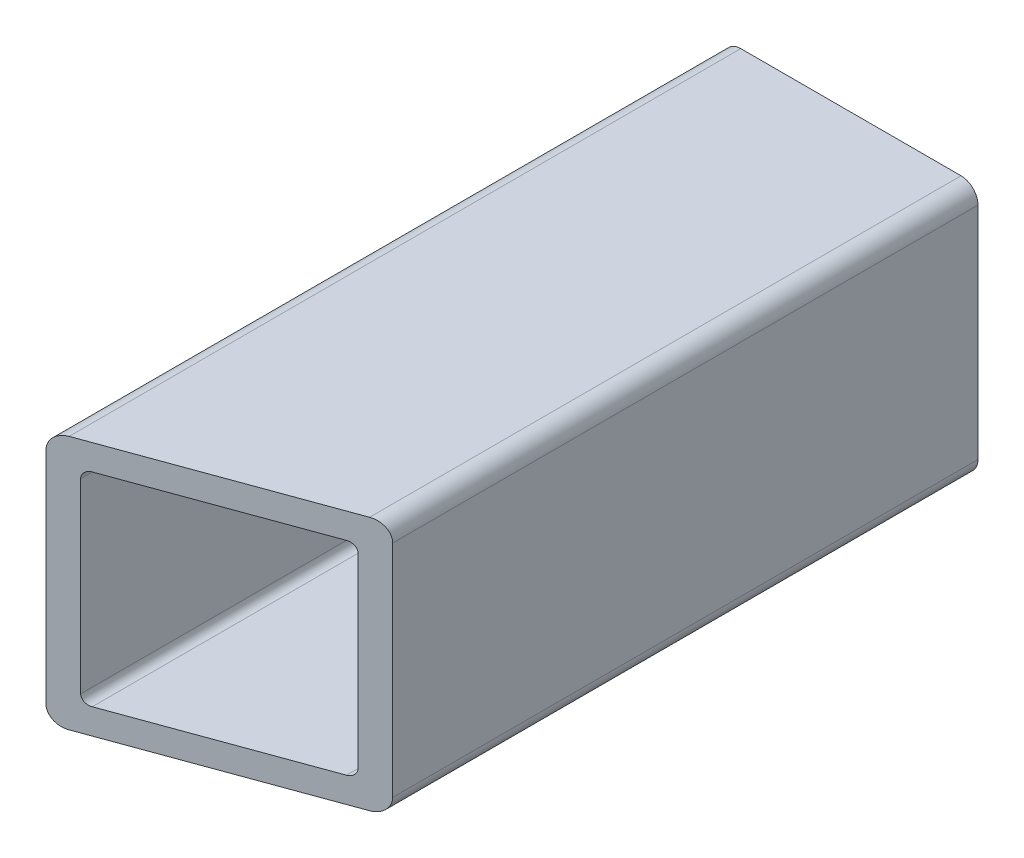
from build123d import *

# Parameters (mm, degrees)
DODANIE_WYCI_GNI_CIE1_DEPTH = 80
WYTNIJ_WYCI_GNI_CIE1_DEPTH  = 70


with BuildPart() as part:
    # Szkic1 → Dodanie-wyciągnięcie1 (new body)
    with BuildSketch(Plane.XY):
        with BuildLine():
            Line((-13, -3), (13, -3))
            ThreePointArc((13, -3), (14.414213562, -2.414213562), (15, -1))
            Line((15, -1), (15, 25))
            ThreePointArc((15, 25), (14.414213562, 26.414213562), (13, 27))
            Line((13, 27), (-13, 27))
            ThreePointArc((-13, 27), (-14.414213562, 26.414213562), (-15, 25))
            Line((-15, 25), (-15, -1))
            ThreePointArc((-15, -1), (-14.414213562, -2.414213562), (-13, -3))
        make_face()
        with BuildLine():
            Line((-11, 0), (11, 0))
            ThreePointArc((11, 0), (11.707106781, 0.292893219), (12, 1))
            Line((12, 1), (12, 23))
            ThreePointArc((12, 23), (11.707106781, 23.707106781), (11, 24))
            Line((11, 24), (-11, 24))
            ThreePointArc((-11, 24), (-11.707106781, 23.707106781), (-12, 23))
            Line((-12, 23), (-12, 1))
            ThreePointArc((-12, 1), (-11.707106781, 0.292893219), (-11, 0))
        make_face(mode=Mode.SUBTRACT)
    extrude(amount=DODANIE_WYCI_GNI_CIE1_DEPTH)

    # Szkic2 → Wytnij-wyciągnięcie1 (cut)
    with BuildSketch(Plane.XZ.offset(3)):
        Polygon((-15, 80), (63.522310859, 51.420216122), (63.522310859, 80), align=None)
    extrude(amount=-WYTNIJ_WYCI_GNI_CIE1_DEPTH, mode=Mode.SUBTRACT)


solid = part.part
